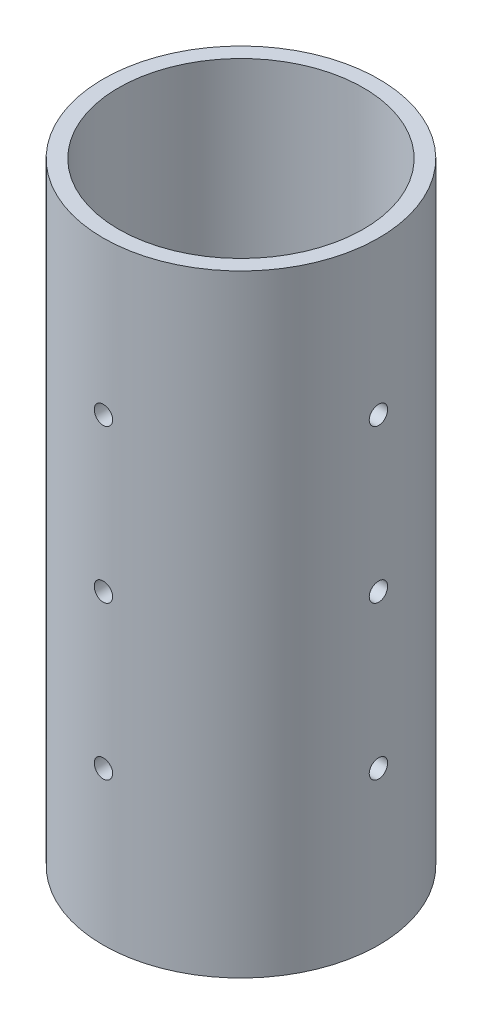
from build123d import *

# Parameters (mm, degrees)
SKETCH1_R                             = 22.5
BOSS_EXTRUDE1_DEPTH                   = 100
TAP_DRILL_FOR_M6X1_0_TAP4_D           = 3
TAP_DRILL_FOR_M6X1_0_TAP5_D           = 3
TAP_DRILL_FOR_M6X1_0_TAP6_D           = 3
TAP_DRILL_FOR_M6X1_0_TAP6_ON_FACE_2_D = 3
TAP_DRILL_FOR_M6X1_0_TAP7_D           = 3
TAP_DRILL_FOR_M6X1_0_TAP7_ON_FACE_2_D = 3
SKETCH12_R                            = 20
CUT_EXTRUDE1_DEPTH                    = 90
SKETCH15_R                            = 2.5
CUT_EXTRUDE2_DEPTH                    = 90


with BuildPart() as part:
    # Sketch1 → Boss-Extrude1 (new body)
    with BuildSketch(Plane(origin=(0, 0, 0), x_dir=(1, 0, 0), z_dir=(0, 1, 0))):
        with Locations(Location((0, 0, 0), (0, 0, 270))):
            Circle(SKETCH1_R)
    extrude(amount=BOSS_EXTRUDE1_DEPTH)

    # Tap Drill for M6x1.0 Tap4 (through all)
    with Locations(Plane(origin=(0, 25, 22.5), x_dir=(1, 0, 0), z_dir=(0, 0, 1))):
        with Locations((0, 0)):
            Hole(TAP_DRILL_FOR_M6X1_0_TAP4_D / 2)

    # Tap Drill for M6x1.0 Tap5 (through all)
    with Locations(Plane(origin=(-22.5, 25, 0), x_dir=(0, 0, -1), z_dir=(-1, 0, 0))):
        with Locations((0, 0)):
            Hole(TAP_DRILL_FOR_M6X1_0_TAP5_D / 2)

    # Tap Drill for M6x1.0 Tap6 (through all)
    with Locations(Plane(origin=(-22.5, 50, 0), x_dir=(0, 0, -1), z_dir=(-1, 0, 0))):
        with Locations((0, 0)):
            Hole(TAP_DRILL_FOR_M6X1_0_TAP6_D / 2)

    # Tap Drill for M6x1.0 Tap6 on face 2 (through all)
    with Locations(Plane(origin=(0, 50, 22.5), x_dir=(1, 0, 0), z_dir=(0, 0, 1))):
        with Locations((0, 0)):
            Hole(TAP_DRILL_FOR_M6X1_0_TAP6_ON_FACE_2_D / 2)

    # Tap Drill for M6x1.0 Tap7 (through all)
    with Locations(Plane(origin=(0, 75, 22.5), x_dir=(1, 0, 0), z_dir=(0, 0, 1))):
        with Locations((0, 0)):
            Hole(TAP_DRILL_FOR_M6X1_0_TAP7_D / 2)

    # Tap Drill for M6x1.0 Tap7 on face 2 (through all)
    with Locations(Plane(origin=(-22.5, 75, 0), x_dir=(0, 0, -1), z_dir=(-1, 0, 0))):
        with Locations((0, 0)):
            Hole(TAP_DRILL_FOR_M6X1_0_TAP7_ON_FACE_2_D / 2)

    # Sketch12 → Cut-Extrude1 (cut)
    with BuildSketch(Plane(origin=(0, 100, 0), x_dir=(1, 0, 0), z_dir=(0, 1, 0))):
        with Locations(Location((0, 0, 0), (0, 0, 270))):
            Circle(SKETCH12_R)
    extrude(amount=-CUT_EXTRUDE1_DEPTH, mode=Mode.SUBTRACT)

    # Sketch15 → Cut-Extrude2 (cut)
    with BuildSketch(Plane.XZ):
        with Locations(Location((0, -3.5, 0), (0, 0, 270))):
            Circle(SKETCH15_R)
        with Locations(Location((0, 11.5, 0), (0, 0, 270))):
            Circle(SKETCH15_R)
    extrude(amount=-CUT_EXTRUDE2_DEPTH, mode=Mode.SUBTRACT)


solid = part.part
